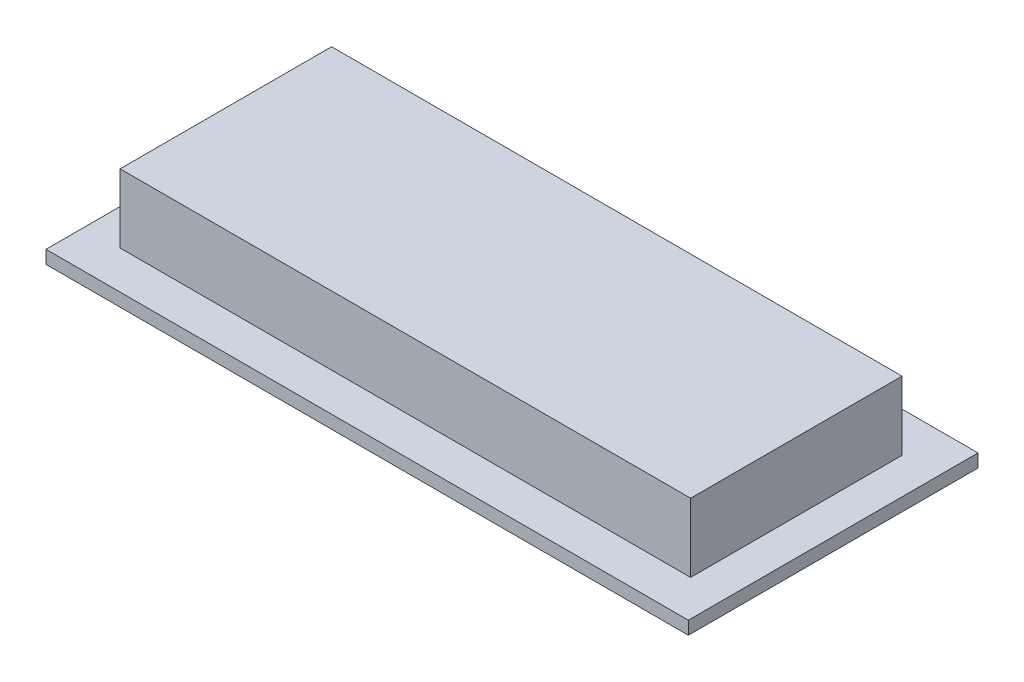
from build123d import *

# Parameters (mm, degrees)
SKETCH1_W           = 79.9338
SKETCH1_H           = 36.0426
BOSS_EXTRUDE1_DEPTH = 1.6256
SKETCH2_W           = 70.993
SKETCH2_H           = 26.3144
BOSS_EXTRUDE2_DEPTH = 8.5344
SKETCH3_W           = 40.64
SKETCH3_H           = 2.54
BOSS_EXTRUDE3_DEPTH = 8.3312


with BuildPart() as part:
    # Sketch1 → Boss-Extrude1 (new body)
    with BuildSketch(Plane(origin=(0, 0, 0), x_dir=(1, 0, 0), z_dir=(0, 1, 0))):
        Rectangle(SKETCH1_W, SKETCH1_H)
    extrude(amount=BOSS_EXTRUDE1_DEPTH)

    # Sketch2 → Boss-Extrude2 (add)
    with BuildSketch(Plane(origin=(0, 1.6256, 0), x_dir=(1, 0, 0), z_dir=(0, 1, 0))):
        with Locations((0, -0.1143)):
            Rectangle(SKETCH2_W, SKETCH2_H)
    extrude(amount=BOSS_EXTRUDE2_DEPTH)

    # Sketch3 → Boss-Extrude3 (add)
    with BuildSketch(Plane.XZ):
        with Locations((-12.9159, -15.7099)):
            Rectangle(SKETCH3_W, SKETCH3_H)
    extrude(amount=BOSS_EXTRUDE3_DEPTH)


solid = part.part
